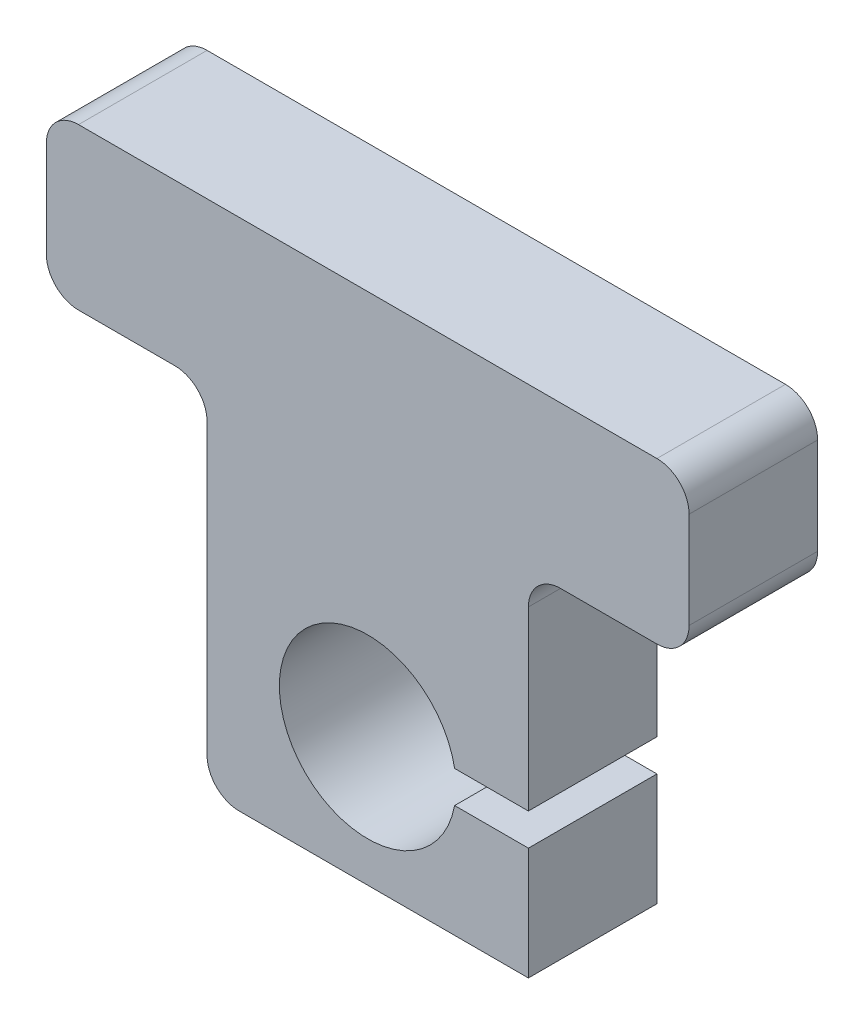
from build123d import *

# Parameters (mm, degrees)
BOSS_EXTRUDE1_DEPTH = 8


with BuildPart() as part:
    # Sketch1 → Boss-Extrude1 (new body)
    with BuildSketch(Plane.XY):
        with BuildLine():
            Line((12, 14), (18, 14))
            ThreePointArc((18, 14), (19.414213562, 14.585786438), (20, 16))
            Line((20, 16), (20, 22))
            ThreePointArc((20, 22), (19.414213562, 23.414213562), (18, 24))
            Line((18, 24), (-18, 24))
            ThreePointArc((-18, 24), (-19.414213562, 23.414213562), (-20, 22))
            Line((-20, 22), (-20, 16))
            ThreePointArc((-20, 16), (-19.414213562, 14.585786438), (-18, 14))
            Line((-18, 14), (-12, 14))
            ThreePointArc((-12, 14), (-10.585786438, 13.414213562), (-10, 12))
            Line((-10, 12), (-10, -6))
            ThreePointArc((-10, -6), (-9.414213562, -7.414213562), (-8, -8))
            Line((-8, -8), (10, -8))
            Line((10, -8), (10, -1))
            Line((10, -1), (5.408326913, -1))
            ThreePointArc((5.408326913, -1), (-5.5, 0), (5.408326913, 1))
            Line((5.408326913, 1), (10, 1))
            Line((10, 1), (10, 12))
            ThreePointArc((10, 12), (10.585786438, 13.414213562), (12, 14))
        make_face()
    extrude(amount=BOSS_EXTRUDE1_DEPTH)


solid = part.part
